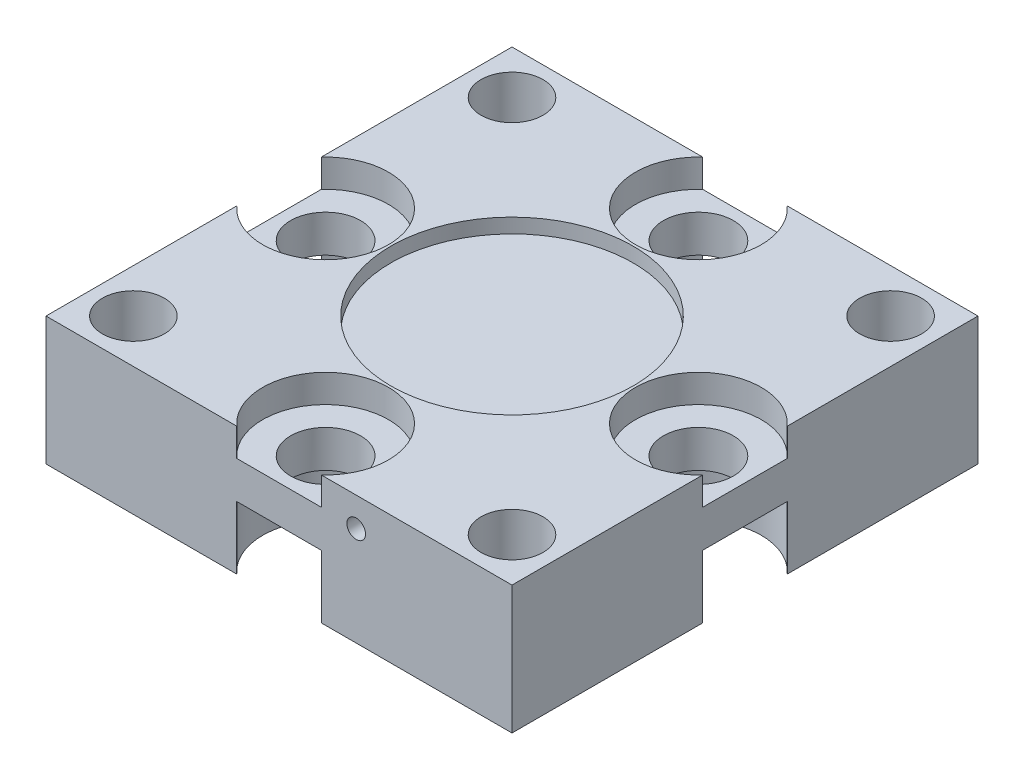
from build123d import *

# Parameters (mm, degrees)
SKETCH1_W               = 50.8
SKETCH1_H               = 50.8
BOSS_EXTRUDE1_DEPTH     = 13.97
F_1_4_CLEARANCE_HOLE1_D = 6.7564
SKETCH5_R               = 13.208
CUT_EXTRUDE1_DEPTH      = 1.5875
SKETCH6_R               = 3.81
CUT_EXTRUDE2_DEPTH      = 39.5419369
SKETCH10_R              = 6.858
CUT_EXTRUDE3_DEPTH      = 3.048
CUT_EXTRUDE4_START      = -6.858
SKETCH11_R              = 6.858
CUT_EXTRUDE4_DEPTH      = 6.858
SKETCH12_R              = 1.016
CUT_EXTRUDE5_DEPTH      = 19.05
CUT_EXTRUDE6_START      = -19.05
SKETCH13_R              = 1.016
CUT_EXTRUDE6_DEPTH      = 19.05


with BuildPart() as part:
    # Sketch1 → Boss-Extrude1 (new body)
    with BuildSketch(Plane(origin=(0, 0, 0), x_dir=(1, 0, 0), z_dir=(0, 1, 0))):
        Rectangle(SKETCH1_W, SKETCH1_H)
    extrude(amount=BOSS_EXTRUDE1_DEPTH)

    # 1/4 Clearance Hole1 (through all)
    with Locations(Plane(origin=(0, 13.97, 0), x_dir=(1, 0, 0), z_dir=(0, 1, 0))):
        with Locations((-20.6375, -20.6375), (-20.6375, 20.6375), (20.6375, 20.6375), (20.6375, -20.6375)):
            Hole(F_1_4_CLEARANCE_HOLE1_D / 2)

    # Sketch5 → Cut-Extrude1 (cut)
    with BuildSketch(Plane(origin=(0, 13.97, 0), x_dir=(1, 0, 0), z_dir=(0, 1, 0))):
        with Locations(Location((0, 0, 0), (0, 0, 270))):
            Circle(SKETCH5_R)
    extrude(amount=-CUT_EXTRUDE1_DEPTH, mode=Mode.SUBTRACT)

    # Sketch6 → Cut-Extrude2 (cut, through all)
    with BuildSketch(Plane(origin=(0, 13.97, 0), x_dir=(1, 0, 0), z_dir=(0, 1, 0))):
        with Locations(Location((0, 20.32, 0), (0, 0, 270))):
            Circle(SKETCH6_R)
        with Locations(Location((20.32, 0, 0), (0, 0, 270))):
            Circle(SKETCH6_R)
        with Locations(Location((0, -20.32, 0), (0, 0, 270))):
            Circle(SKETCH6_R)
        with Locations(Location((-20.32, 0, 0), (0, 0, 270))):
            Circle(SKETCH6_R)
    extrude(amount=-CUT_EXTRUDE2_DEPTH, mode=Mode.SUBTRACT)

    # Sketch10 → Cut-Extrude3 (cut)
    with BuildSketch(Plane(origin=(0, 13.97, 0), x_dir=(1, 0, 0), z_dir=(0, 1, 0))):
        with Locations((-20.32, 0)):
            Circle(SKETCH10_R)
        with Locations((0, 20.32)):
            Circle(SKETCH10_R)
        with Locations((20.32, 0)):
            Circle(SKETCH10_R)
        with Locations((0, -20.32)):
            Circle(SKETCH10_R)
    extrude(amount=-CUT_EXTRUDE3_DEPTH, mode=Mode.SUBTRACT)

    # Sketch11 → Cut-Extrude4 (cut)
    with BuildSketch(Plane.XZ.offset(CUT_EXTRUDE4_START)):
        with Locations((-20.32, 0)):
            Circle(SKETCH11_R)
        with Locations((0, 20.32)):
            Circle(SKETCH11_R)
        with Locations((20.32, 0)):
            Circle(SKETCH11_R)
        with Locations((0, -20.32)):
            Circle(SKETCH11_R)
    extrude(amount=CUT_EXTRUDE4_DEPTH, mode=Mode.SUBTRACT)

    # Sketch12 → Cut-Extrude5 (cut)
    with BuildSketch(Plane.XY.offset(25.4)):
        with Locations((8.417142715, 10.795)):
            Circle(SKETCH12_R)
    extrude(amount=-CUT_EXTRUDE5_DEPTH, mode=Mode.SUBTRACT)

    # Sketch13 → Cut-Extrude6 (cut)
    with BuildSketch(Plane(origin=(0, 0, -25.4), x_dir=(-1, 0, 0), z_dir=(0, 0, -1)).offset(CUT_EXTRUDE6_START)):
        with Locations(Location((-8.417142715, 10.795, 0), (0, 0, 180))):
            Circle(SKETCH13_R)
    extrude(amount=CUT_EXTRUDE6_DEPTH, mode=Mode.SUBTRACT)


solid = part.part
